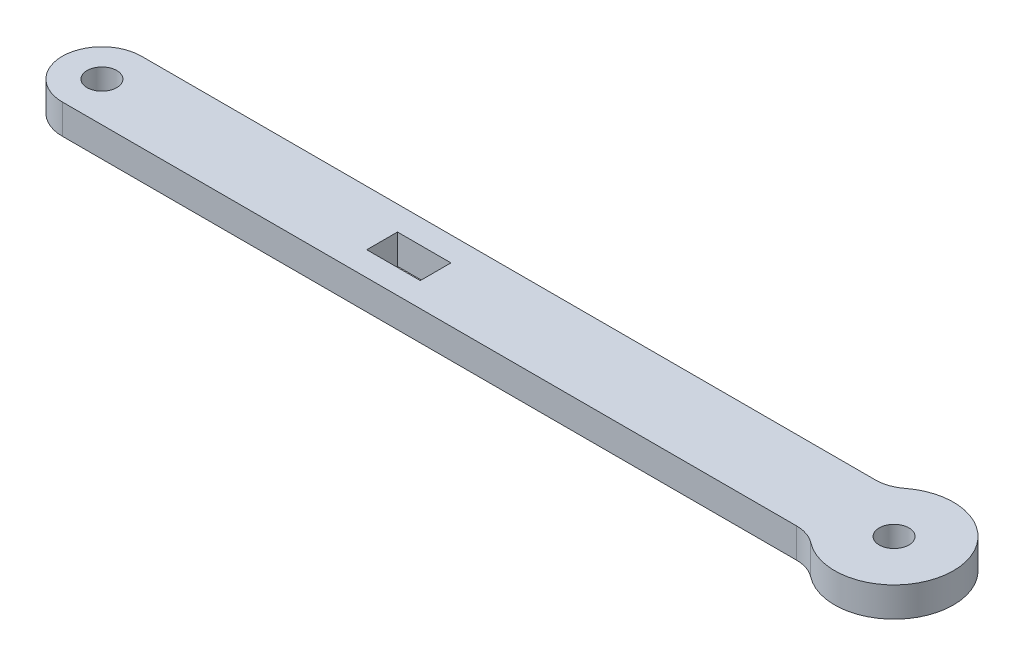
from build123d import *

# Parameters (mm, degrees)
RESSALTO_EXTRUS_O1_DEPTH   = 3
ESBO_O2_W                  = 5.4
ESBO_O2_H                  = 3.1
CORTE_EXTRUS_O1_DEPTH      = 87.261231153
FURO_DE_DI_METRO_3_0_3_1_D = 3


with BuildPart() as part:
    # Esboço1 → Ressalto-extrusão1 (new body)
    with BuildSketch(Plane(origin=(0, 0, 0), x_dir=(1, 0, 0), z_dir=(0, 1, 0))):
        with BuildLine():
            Line((0, 4), (74.134848681, 4))
            ThreePointArc((74.134848681, 4), (75.296743684, 4.192654993), (76.334280425, 4.75))
            ThreePointArc((76.334280425, 4.75), (86, 0), (76.334280425, -4.75))
            ThreePointArc((76.334280425, -4.75), (75.296743684, -4.192654993), (74.134848681, -4))
            Line((74.134848681, -4), (0, -4))
            ThreePointArc((0, -4), (-4, 0), (0, 4))
        make_face()
    extrude(amount=-RESSALTO_EXTRUS_O1_DEPTH)

    # Esboço2 → Corte-extrusão1 (cut, through all)
    with BuildSketch(Plane(origin=(0, 0, 0), x_dir=(1, 0, 0), z_dir=(0, 1, 0))):
        with Locations((31, 0)):
            Rectangle(ESBO_O2_W, ESBO_O2_H)
    extrude(amount=-CORTE_EXTRUS_O1_DEPTH, mode=Mode.SUBTRACT)

    # Furo de diâmetro Ø3.0 (3)1 (through all)
    with Locations(Plane(origin=(0, 0, 0), x_dir=(1, 0, 0), z_dir=(0, 1, 0))):
        with Locations((0, 0), (80, 0)):
            Hole(FURO_DE_DI_METRO_3_0_3_1_D / 2)


solid = part.part
